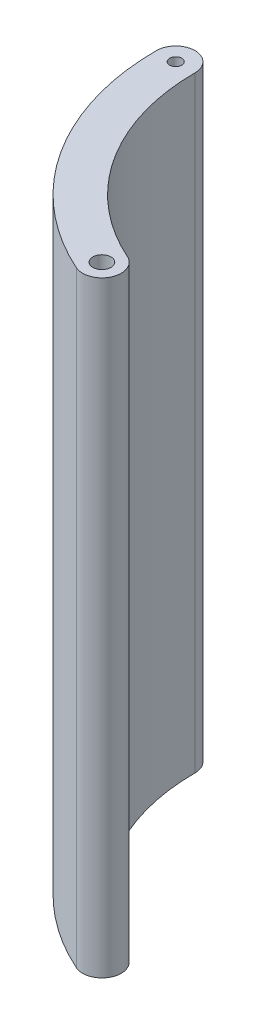
from build123d import *

# Parameters (mm, degrees)
ESQUISSE1_R        = 1
ESQUISSE1_R_2      = 1.5
BOSS_EXTRU_1_DEPTH = 100


with BuildPart() as part:
    # Esquisse1 → Boss.-Extru.1 (new body)
    with BuildSketch(Plane(origin=(0, 0, 0), x_dir=(1, 0, 0), z_dir=(0, 1, 0))):
        with BuildLine():
            ThreePointArc((-41.18, 0), (-34.536453988, -22.428235462), (-16.749414962, -37.619801946))
            ThreePointArc((-16.749414962, -37.619801946), (-12.550917882, -36.008149915), (-14.162569912, -31.809652835))
            ThreePointArc((-14.162569912, -31.809652835), (-29.202509176, -18.964331199), (-34.82, 0))
            ThreePointArc((-34.82, 0), (-38, 3.18), (-41.18, 0))
        make_face()
        with Locations(Location((-38, 0, 0), (0, 0, 270))):
            Circle(ESQUISSE1_R, mode=Mode.SUBTRACT)
        with Locations(Location((-15.455992437, -34.71472739, 0), (0, 0, 270))):
            Circle(ESQUISSE1_R_2, mode=Mode.SUBTRACT)
    extrude(amount=BOSS_EXTRU_1_DEPTH)


solid = part.part
